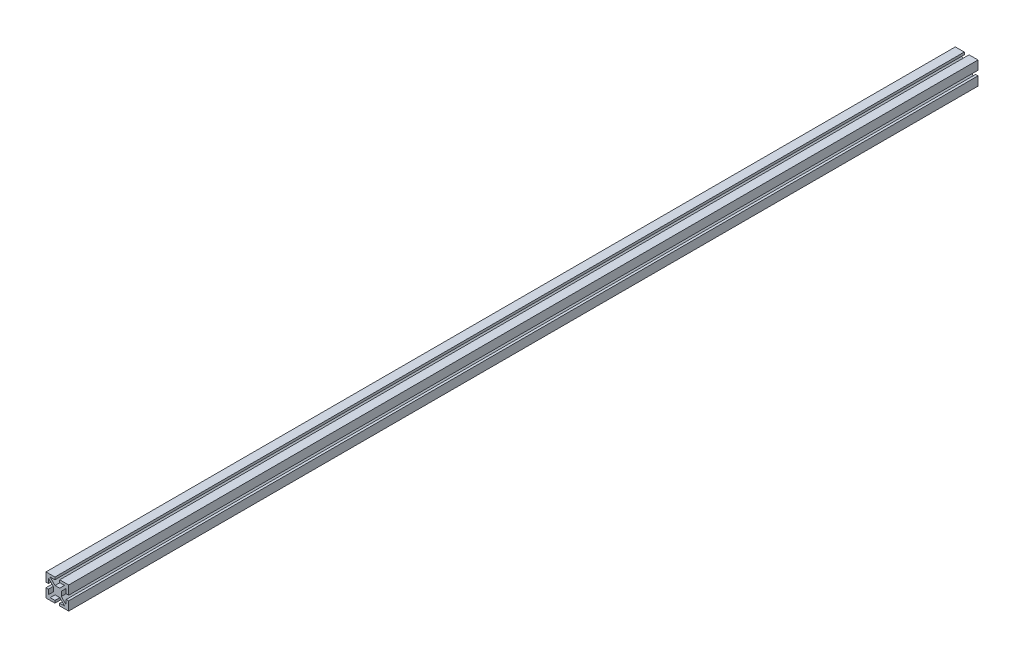
from build123d import *

# Parameters (mm, degrees)
BOSS_EXTRUDE1_DEPTH = 1528.7625


with BuildPart() as part:
    # Sketch2 → Boss-Extrude1 (new body)
    with BuildSketch(Plane(origin=(0.594697292, -0.594697292, 0), x_dir=(1, 0, 0), z_dir=(0, 0, 1))):
        Polygon((-19.644697292, 19.644697292), (-4.658697292, 19.644697292), (-4.658697292, 15.580697292), (-12.707015333, 15.580697292), (-4.477415333, 7.351097292), (3.288020749, 7.351097292), (11.517620749, 15.580697292), (3.469302708, 15.580697292), (3.469302708, 19.644697292), (18.455302708, 19.644697292), (18.455302708, 4.658697292), (14.391302708, 4.658697292), (14.391302708, 12.707015333), (6.161702708, 4.477415333), (6.161702708, -3.288020749), (14.391302708, -11.517620749), (14.391302708, -3.469302708), (18.455302708, -3.469302708), (18.455302708, -18.455302708), (3.469302708, -18.455302708), (3.469302708, -14.391302708), (11.517620749, -14.391302708), (3.288020749, -6.161702708), (-4.477415333, -6.161702708), (-12.707015333, -14.391302708), (-4.658697292, -14.391302708), (-4.658697292, -18.455302708), (-19.644697292, -18.455302708), (-19.644697292, -3.469302708), (-15.580697292, -3.469302708), (-15.580697292, -11.517620749), (-7.351097292, -3.288020749), (-7.351097292, 4.477415333), (-15.580697292, 12.707015333), (-15.580697292, 4.658697292), (-19.644697292, 4.658697292), align=None)
    extrude(amount=BOSS_EXTRUDE1_DEPTH)


solid = part.part
